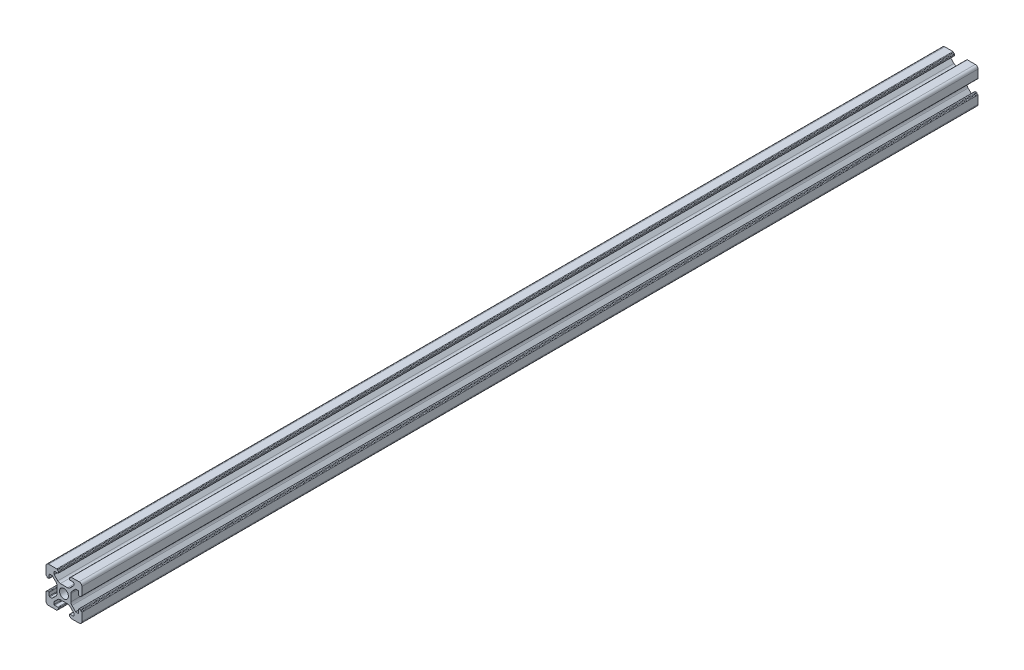
from build123d import *

# Parameters (mm, degrees)
SKETCH_1_R      = 2.5
EXTRUDE_1_DEPTH = 500


with BuildPart() as part:
    # 草图1 → 凸台-拉伸1 (new body)
    with BuildSketch(Plane.XY):
        with BuildLine():
            Line((10, 8.532915167), (10, 4.032915167))
            ThreePointArc((10, 4.032915167), (9.912132034, 3.820783133), (9.7, 3.732915167))
            ThreePointArc((9.7, 3.732915167), (9.487867966, 3.645047202), (9.4, 3.432915167))
            ThreePointArc((9.4, 3.432915167), (9.312132034, 3.220783133), (9.1, 3.132915167))
            Line((9.1, 3.132915167), (8.5, 3.132915167))
            ThreePointArc((8.5, 3.132915167), (8.287867966, 3.220783133), (8.2, 3.432915167))
            Line((8.2, 3.432915167), (8.2, 5.232915167))
            ThreePointArc((8.2, 5.232915167), (8.112132034, 5.445047202), (7.9, 5.532915167))
            Line((7.9, 5.532915167), (6.68492424, 5.532915167))
            ThreePointArc((6.68492424, 5.532915167), (6.570119211, 5.510079027), (6.472792206, 5.445047202))
            Line((6.472792206, 5.445047202), (4.485786438, 3.458041433))
            ThreePointArc((4.485786438, 3.458041433), (4.052240935, 2.809194736), (3.9, 2.043827871))
            Line((3.9, 2.043827871), (3.9, -1.977997536))
            ThreePointArc((3.9, -1.977997536), (4.052240935, -2.743364401), (4.485786438, -3.392211098))
            Line((4.485786438, -3.392211098), (6.472792206, -5.379216867))
            ThreePointArc((6.472792206, -5.379216867), (6.570119211, -5.444248692), (6.68492424, -5.467084833))
            Line((6.68492424, -5.467084833), (7.9, -5.467084833))
            ThreePointArc((7.9, -5.467084833), (8.112132034, -5.379216867), (8.2, -5.167084833))
            Line((8.2, -5.167084833), (8.2, -3.367084833))
            ThreePointArc((8.2, -3.367084833), (8.287867966, -3.154952798), (8.5, -3.067084833))
            Line((8.5, -3.067084833), (9.1, -3.067084833))
            ThreePointArc((9.1, -3.067084833), (9.312132034, -3.154952798), (9.4, -3.367084833))
            ThreePointArc((9.4, -3.367084833), (9.487867966, -3.579216867), (9.7, -3.667084833))
            ThreePointArc((9.7, -3.667084833), (9.912132034, -3.754952798), (10, -3.967084833))
            Line((10, -3.967084833), (10, -8.467084833))
            ThreePointArc((10, -8.467084833), (9.560660172, -9.527745004), (8.5, -9.967084833))
            Line((8.5, -9.967084833), (4, -9.967084833))
            ThreePointArc((4, -9.967084833), (3.787867966, -9.879216867), (3.7, -9.667084833))
            ThreePointArc((3.7, -9.667084833), (3.612132034, -9.454952798), (3.4, -9.367084833))
            ThreePointArc((3.4, -9.367084833), (3.187867966, -9.279216867), (3.1, -9.067084833))
            Line((3.1, -9.067084833), (3.1, -8.467084833))
            ThreePointArc((3.1, -8.467084833), (3.187867966, -8.254952798), (3.4, -8.167084833))
            Line((3.4, -8.167084833), (5.2, -8.167084833))
            ThreePointArc((5.2, -8.167084833), (5.412132034, -8.079216867), (5.5, -7.867084833))
            Line((5.5, -7.867084833), (5.5, -6.652009073))
            ThreePointArc((5.5, -6.652009073), (5.47716386, -6.537204043), (5.412132034, -6.439877039))
            Line((5.412132034, -6.439877039), (3.425126266, -4.45287127))
            ThreePointArc((3.425126266, -4.45287127), (2.776279568, -4.019325767), (2.010912703, -3.867084833))
            Line((2.010912703, -3.867084833), (-2.010912703, -3.867084833))
            ThreePointArc((-2.010912703, -3.867084833), (-2.776279568, -4.019325767), (-3.425126266, -4.45287127))
            Line((-3.425126266, -4.45287127), (-5.412132034, -6.439877039))
            ThreePointArc((-5.412132034, -6.439877039), (-5.47716386, -6.537204043), (-5.5, -6.652009073))
            Line((-5.5, -6.652009073), (-5.5, -7.867084833))
            ThreePointArc((-5.5, -7.867084833), (-5.412132034, -8.079216867), (-5.2, -8.167084833))
            Line((-5.2, -8.167084833), (-3.4, -8.167084833))
            ThreePointArc((-3.4, -8.167084833), (-3.187867966, -8.254952798), (-3.1, -8.467084833))
            Line((-3.1, -8.467084833), (-3.1, -9.067084833))
            ThreePointArc((-3.1, -9.067084833), (-3.187867966, -9.279216867), (-3.4, -9.367084833))
            ThreePointArc((-3.4, -9.367084833), (-3.612132034, -9.454952798), (-3.7, -9.667084833))
            ThreePointArc((-3.7, -9.667084833), (-3.787867966, -9.879216867), (-4, -9.967084833))
            Line((-4, -9.967084833), (-8.5, -9.967084833))
            ThreePointArc((-8.5, -9.967084833), (-9.560660172, -9.527745004), (-10, -8.467084833))
            Line((-10, -8.467084833), (-10, -3.967084833))
            ThreePointArc((-10, -3.967084833), (-9.912132034, -3.754952798), (-9.7, -3.667084833))
            ThreePointArc((-9.7, -3.667084833), (-9.487867966, -3.579216867), (-9.4, -3.367084833))
            ThreePointArc((-9.4, -3.367084833), (-9.312132034, -3.154952798), (-9.1, -3.067084833))
            Line((-9.1, -3.067084833), (-8.5, -3.067084833))
            ThreePointArc((-8.5, -3.067084833), (-8.287867966, -3.154952798), (-8.2, -3.367084833))
            Line((-8.2, -3.367084833), (-8.2, -5.167084833))
            ThreePointArc((-8.2, -5.167084833), (-8.112132034, -5.379216867), (-7.9, -5.467084833))
            Line((-7.9, -5.467084833), (-6.68492424, -5.467084833))
            ThreePointArc((-6.68492424, -5.467084833), (-6.570119211, -5.444248692), (-6.472792206, -5.379216867))
            Line((-6.472792206, -5.379216867), (-4.485786438, -3.392211098))
            ThreePointArc((-4.485786438, -3.392211098), (-4.052240935, -2.743364401), (-3.9, -1.977997536))
            Line((-3.9, -1.977997536), (-3.9, 2.043827871))
            ThreePointArc((-3.9, 2.043827871), (-4.052240935, 2.809194736), (-4.485786438, 3.458041433))
            Line((-4.485786438, 3.458041433), (-6.472792206, 5.445047202))
            ThreePointArc((-6.472792206, 5.445047202), (-6.570119211, 5.510079027), (-6.68492424, 5.532915167))
            Line((-6.68492424, 5.532915167), (-7.9, 5.532915167))
            ThreePointArc((-7.9, 5.532915167), (-8.112132034, 5.445047202), (-8.2, 5.232915167))
            Line((-8.2, 5.232915167), (-8.2, 3.432915167))
            ThreePointArc((-8.2, 3.432915167), (-8.287867966, 3.220783133), (-8.5, 3.132915167))
            Line((-8.5, 3.132915167), (-9.1, 3.132915167))
            ThreePointArc((-9.1, 3.132915167), (-9.312132034, 3.220783133), (-9.4, 3.432915167))
            ThreePointArc((-9.4, 3.432915167), (-9.487867966, 3.645047202), (-9.7, 3.732915167))
            ThreePointArc((-9.7, 3.732915167), (-9.912132034, 3.820783133), (-10, 4.032915167))
            Line((-10, 4.032915167), (-10, 8.532915167))
            ThreePointArc((-10, 8.532915167), (-9.560660172, 9.593575339), (-8.5, 10.032915167))
            Line((-8.5, 10.032915167), (-4, 10.032915167))
            ThreePointArc((-4, 10.032915167), (-3.787867966, 9.945047202), (-3.7, 9.732915167))
            ThreePointArc((-3.7, 9.732915167), (-3.612132034, 9.520783133), (-3.4, 9.432915167))
            ThreePointArc((-3.4, 9.432915167), (-3.187867966, 9.345047202), (-3.1, 9.132915167))
            Line((-3.1, 9.132915167), (-3.1, 8.532915167))
            ThreePointArc((-3.1, 8.532915167), (-3.187867966, 8.320783133), (-3.4, 8.232915167))
            Line((-3.4, 8.232915167), (-5.2, 8.232915167))
            ThreePointArc((-5.2, 8.232915167), (-5.412132034, 8.145047202), (-5.5, 7.932915167))
            Line((-5.5, 7.932915167), (-5.5, 6.717839408))
            ThreePointArc((-5.5, 6.717839408), (-5.47716386, 6.603034378), (-5.412132034, 6.505707374))
            Line((-5.412132034, 6.505707374), (-3.425126266, 4.518701605))
            ThreePointArc((-3.425126266, 4.518701605), (-2.776279568, 4.085156102), (-2.010912703, 3.932915167))
            Line((-2.010912703, 3.932915167), (2.010912703, 3.932915167))
            ThreePointArc((2.010912703, 3.932915167), (2.776279568, 4.085156102), (3.425126266, 4.518701605))
            Line((3.425126266, 4.518701605), (5.412132034, 6.505707374))
            ThreePointArc((5.412132034, 6.505707374), (5.47716386, 6.603034378), (5.5, 6.717839408))
            Line((5.5, 6.717839408), (5.5, 7.932915167))
            ThreePointArc((5.5, 7.932915167), (5.412132034, 8.145047202), (5.2, 8.232915167))
            Line((5.2, 8.232915167), (3.4, 8.232915167))
            ThreePointArc((3.4, 8.232915167), (3.187867966, 8.320783133), (3.1, 8.532915167))
            Line((3.1, 8.532915167), (3.1, 9.132915167))
            ThreePointArc((3.1, 9.132915167), (3.187867966, 9.345047202), (3.4, 9.432915167))
            ThreePointArc((3.4, 9.432915167), (3.612132034, 9.520783133), (3.7, 9.732915167))
            ThreePointArc((3.7, 9.732915167), (3.787867966, 9.945047202), (4, 10.032915167))
            Line((4, 10.032915167), (8.5, 10.032915167))
            ThreePointArc((8.5, 10.032915167), (9.560660172, 9.593575339), (10, 8.532915167))
        make_face()
        with Locations((0, 0.032915167)):
            Circle(SKETCH_1_R, mode=Mode.SUBTRACT)
    extrude(amount=EXTRUDE_1_DEPTH)


solid = part.part
